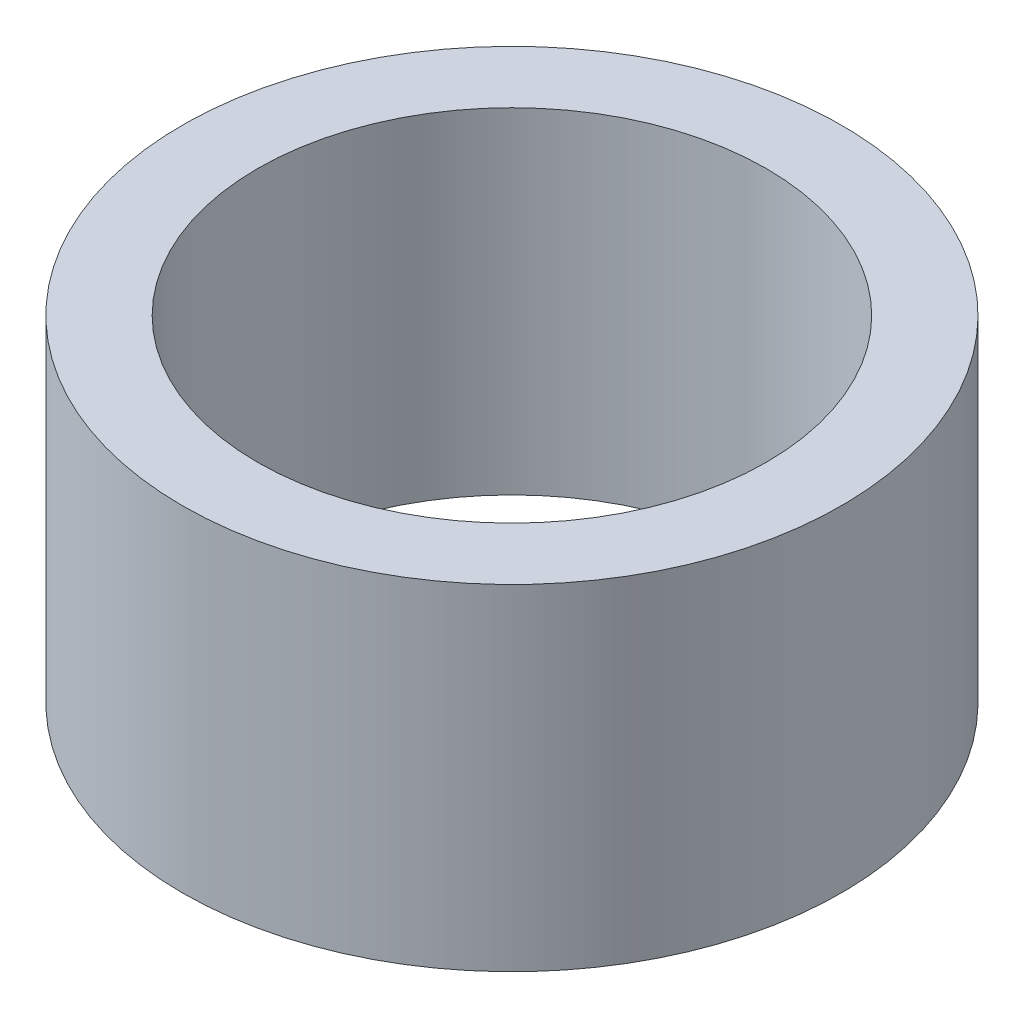
from build123d import *

# Parameters (mm, degrees)
SKETCH1_R           = 28.5
SKETCH1_R_2         = 22
BOSS_EXTRUDE1_DEPTH = 29


with BuildPart() as part:
    # Sketch1 → Boss-Extrude1 (new body)
    with BuildSketch(Plane(origin=(0, 0, 0), x_dir=(1, 0, 0), z_dir=(0, 1, 0))):
        with Locations(Location((0, 0, 0), (0, 0, 270))):
            Circle(SKETCH1_R)
        with Locations(Location((0, 0, 0), (0, 0, 270))):
            Circle(SKETCH1_R_2, mode=Mode.SUBTRACT)
    extrude(amount=BOSS_EXTRUDE1_DEPTH)


solid = part.part
